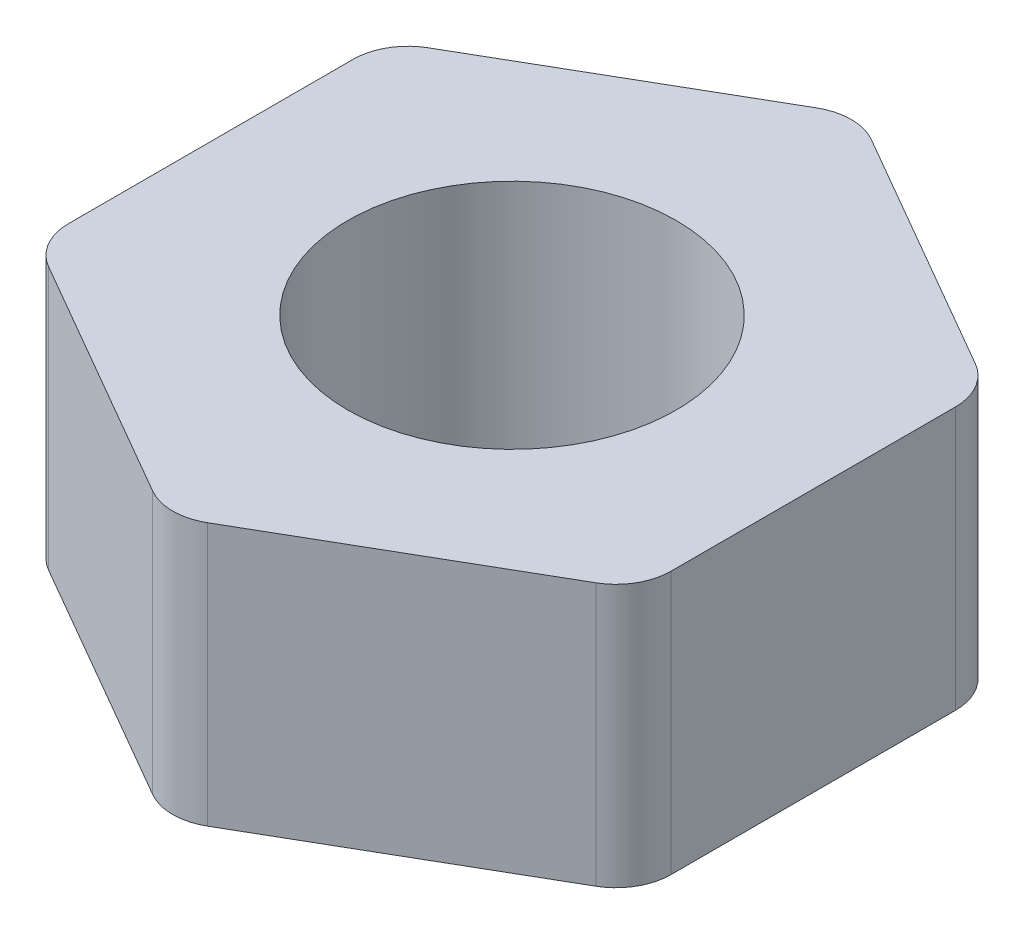
from build123d import *

# Parameters (mm, degrees)
SKETCH_1_R      = 1.5
EXTRUDE_1_DEPTH = 2.4
FILLET_1_R      = 0.5


with BuildPart() as part:
    # 草图1 → 凸台-拉伸1 (new body)
    with BuildSketch(Plane(origin=(0, 0, 0), x_dir=(1, 0, 0), z_dir=(0, 1, 0))):
        Polygon((0, 3.175426481), (-2.75, 1.58771324), (-2.75, -1.58771324), (0, -3.175426481), (2.75, -1.58771324), (2.75, 1.58771324), align=None)
        with Locations(Location((0, 0, 0), (0, 0, 270))):
            Circle(SKETCH_1_R, mode=Mode.SUBTRACT)
    extrude(amount=EXTRUDE_1_DEPTH)

    # 圆角1
    fillet_1_edges = [part.edges().sort_by_distance(p)[0] for p in [
        (2.75, 1.2, -1.58771324),
        (2.75, 1.2, 1.58771324),
        (0, 1.2, 3.175426481),
        (-2.75, 1.2, 1.58771324),
        (-2.75, 1.2, -1.58771324),
        (0, 1.2, -3.175426481),
    ]]
    fillet(fillet_1_edges, radius=FILLET_1_R)


solid = part.part
